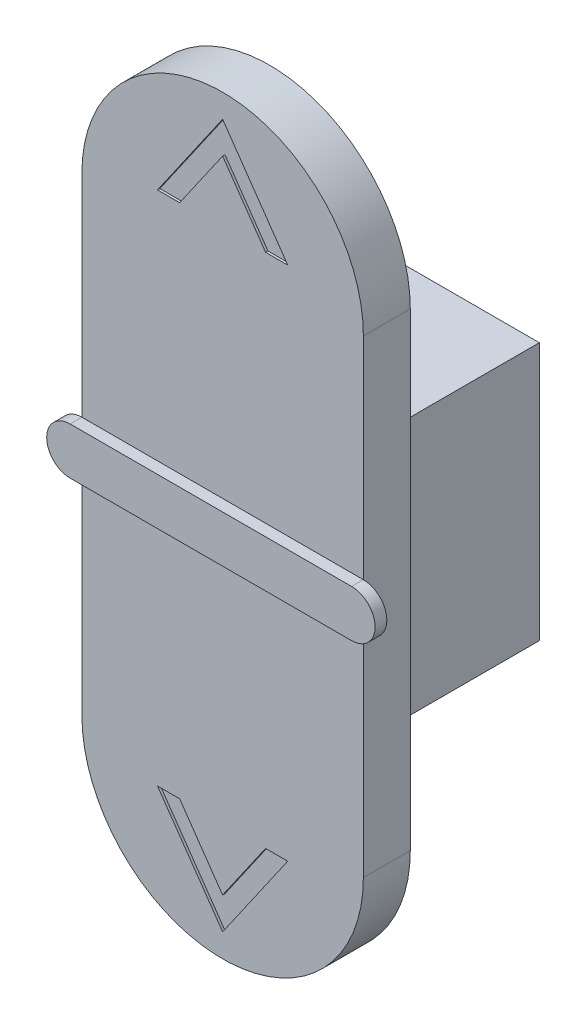
from build123d import *

# Parameters (mm, degrees)
BOSS_EXTRUDE1_DEPTH = 2
BOSS_EXTRUDE2_DEPTH = 0.5
CUT_EXTRUDE1_DEPTH  = 0.1
SKETCH4_W           = 11
SKETCH4_H           = 11
SKETCH4_W_2         = 9
SKETCH4_H_2         = 9
EXTRUDE_THIN1_DEPTH = 6


with BuildPart() as part:
    # Sketch1 → Boss-Extrude1 (new body)
    with BuildSketch(Plane.XY):
        with BuildLine():
            Line((6, 10), (6, -10))
            ThreePointArc((6, -10), (0, -16), (-6, -10))
            Line((-6, -10), (-6, 10))
            ThreePointArc((-6, 10), (0, 16), (6, 10))
        make_face()
    extrude(amount=BOSS_EXTRUDE1_DEPTH)

    # Sketch2 → Boss-Extrude2 (add)
    with BuildSketch(Plane.XY.offset(2)):
        with BuildLine():
            Line((-6, 1), (6, 1))
            ThreePointArc((6, 1), (7, 0), (6, -1))
            Line((6, -1), (-6, -1))
            ThreePointArc((-6, -1), (-7, 0), (-6, 1))
        make_face()
    extrude(amount=BOSS_EXTRUDE2_DEPTH)

    # Sketch3 → Cut-Extrude1 (cut)
    with BuildSketch(Plane.XY.offset(2)):
        Polygon((0, 15), (-2.775609333, 11.00312256), (-1.83190216, 11.00312256), (0, 13.641061671), (1.83190216, 11.00312256), (2.775609333, 11.00312256), align=None)
        Polygon((-2.775609333, -11.00312256), (-1.83190216, -11.00312256), (0, -13.641061671), (1.83190216, -11.00312256), (2.775609333, -11.00312256), (0, -15), align=None)
    extrude(amount=-CUT_EXTRUDE1_DEPTH, mode=Mode.SUBTRACT)

    # Sketch4 → Extrude-Thin1 (add)
    with BuildSketch(Plane(origin=(0, 0, 0), x_dir=(-1, 0, 0), z_dir=(0, 0, -1))):
        Rectangle(SKETCH4_W, SKETCH4_H)
        Rectangle(SKETCH4_W_2, SKETCH4_H_2, mode=Mode.SUBTRACT)
    extrude(amount=EXTRUDE_THIN1_DEPTH)


solid = part.part
